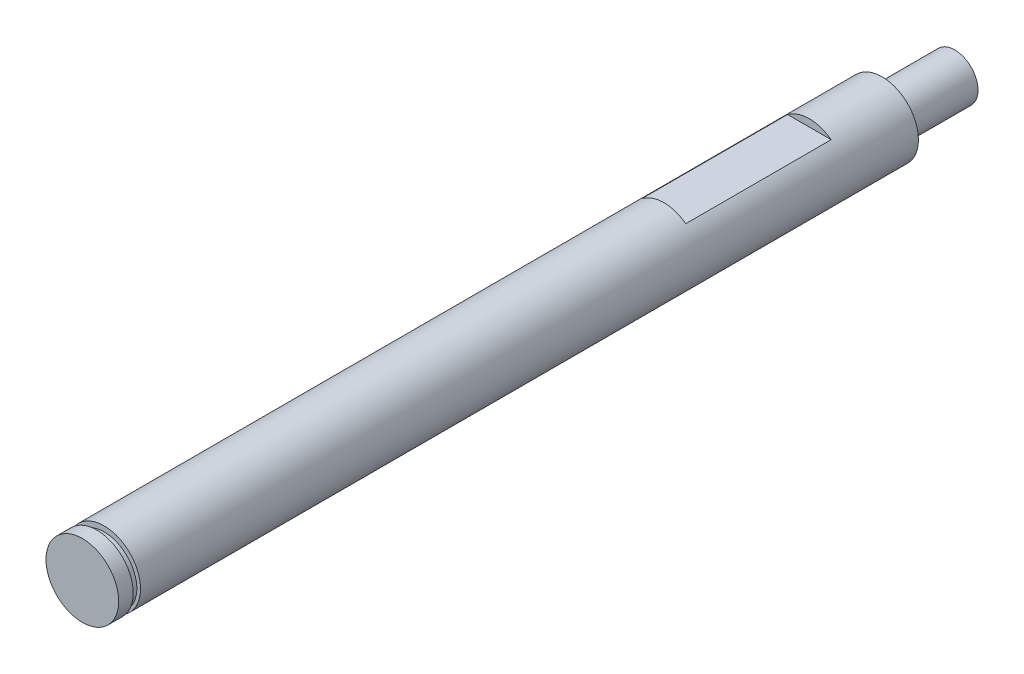
from build123d import *

# Parameters (mm, degrees)
SKETCH1_R           = 1.6
BOSS_EXTRUDE1_DEPTH = 5
SKETCH2_R           = 2.5
BOSS_EXTRUDE2_DEPTH = 55
SKETCH5_W           = 8.290876423
SKETCH5_H           = 10
CUT_EXTRUDE1_DEPTH  = 0.5


with BuildPart() as part:
    # Sketch1 → Boss-Extrude1 (new body)
    with BuildSketch(Plane.XY):
        Circle(SKETCH1_R)
    extrude(amount=BOSS_EXTRUDE1_DEPTH)

    # Sketch2 → Boss-Extrude2 (add)
    with BuildSketch(Plane.XY.offset(5)):
        Circle(SKETCH2_R)
    extrude(amount=BOSS_EXTRUDE2_DEPTH)

    # Sketch4 → Groove for ANSI B27.7 - 3BM1-8, Basic Internal Retaining Ring1 (revolve, cut)
    with BuildSketch(Plane(origin=(0, 0, 54), x_dir=(0, 1, 0), z_dir=(-1, 0, 0)), mode=Mode.PRIVATE) as groove_for_ansi_b27_7_3bm1_8_basic_in_sk:
        with BuildLine():
            Line((4.1, -5), (2.14, -5))
            Line((2.14, -5), (2.14, -4.5))
            Line((2.14, -4.5), (4.1, -4.5))
            ThreePointArc((4.1, -4.5), (4.170710678, -4.529289322), (4.2, -4.6))
            Line((4.2, -4.6), (4.2, -4.9))
            ThreePointArc((4.2, -4.9), (4.170710678, -4.970710678), (4.1, -5))
        make_face()
    revolve(groove_for_ansi_b27_7_3bm1_8_basic_in_sk.sketch.rotate(Axis((0, -0.105559952, 104), (0, 0, -1)), 270), axis=Axis((0, -0.105559952, 104), (0, 0, -1)), mode=Mode.SUBTRACT)

    # Sketch5 → Cut-Extrude1 (cut)
    with BuildSketch(Plane.XZ.offset(2.5)):
        with Locations((-0.404897295, 15)):
            Rectangle(SKETCH5_W, SKETCH5_H)
    cut_extrude1 = extrude(amount=-CUT_EXTRUDE1_DEPTH, mode=Mode.SUBTRACT)

    # Mirror1: Cut-Extrude1 across plane
    add(cut_extrude1.mirror(Plane.ZX), mode=Mode.SUBTRACT)


solid = part.part
